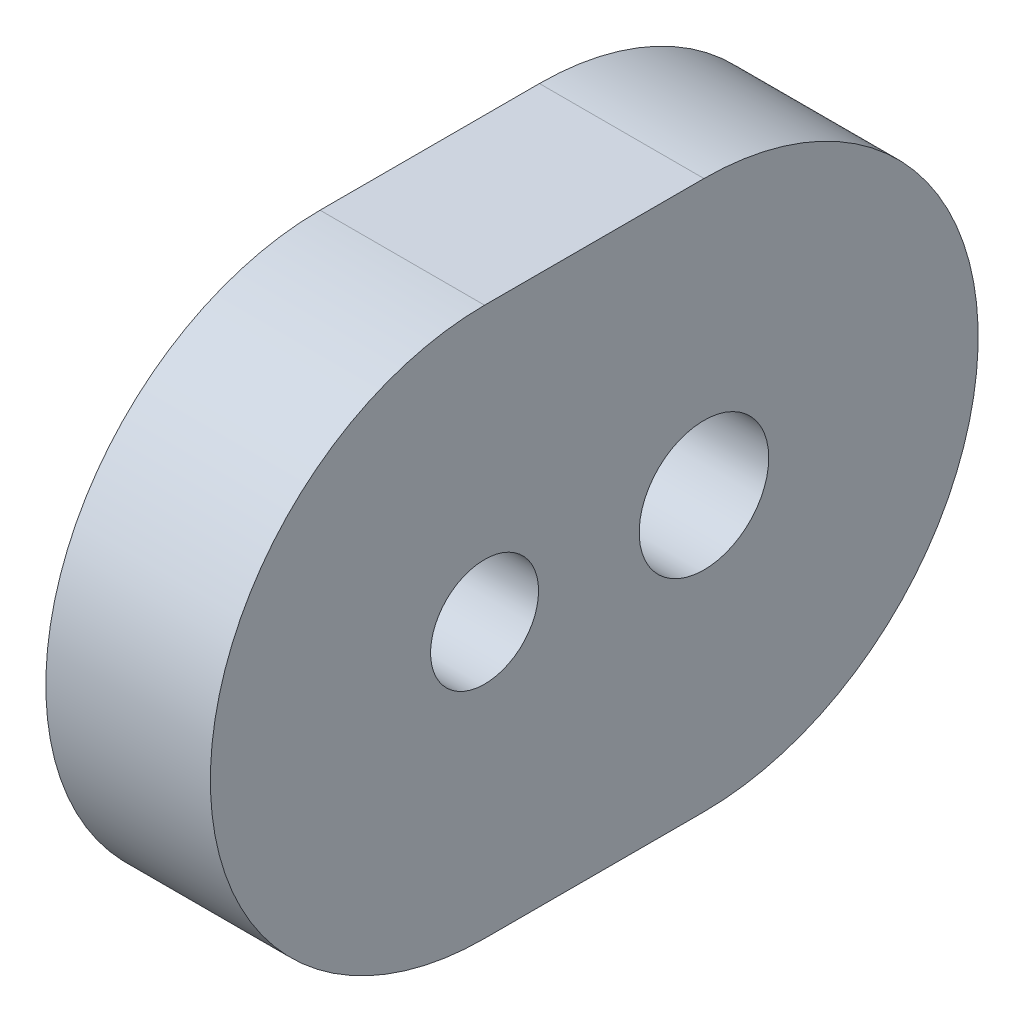
from build123d import *

# Parameters (mm, degrees)
BOSS_EXTRUDE1_DEPTH     = 3.81
TAP_DRILL_FOR_M3_TAP1_D = 2.5
F_3_0MM_DOWEL_HOLE1_D   = 3


with BuildPart() as part:
    # Sketch1 → Boss-Extrude1 (new body)
    with BuildSketch(Plane(origin=(0, 0, 0), x_dir=(0, 0, -1), z_dir=(1, 0, 0))):
        with BuildLine():
            Line((0, 0), (5.08, 0))
            ThreePointArc((5.08, 0), (11.43, 6.35), (5.08, 12.7))
            Line((5.08, 12.7), (0, 12.7))
            ThreePointArc((0, 12.7), (-6.35, 6.35), (0, 0))
        make_face()
    extrude(amount=BOSS_EXTRUDE1_DEPTH)

    # Tap Drill for M3 Tap1 (through all)
    with Locations(Plane(origin=(3.81, 0, 0), x_dir=(0, 0, -1), z_dir=(1, 0, 0))):
        with Locations((0, 6.35)):
            Hole(TAP_DRILL_FOR_M3_TAP1_D / 2)

    # Ø3.0mm Dowel Hole1 (through all)
    with Locations(Plane(origin=(3.81, 0, 0), x_dir=(0, 0, -1), z_dir=(1, 0, 0))):
        with Locations((5.08, 6.35)):
            Hole(F_3_0MM_DOWEL_HOLE1_D / 2)


solid = part.part
